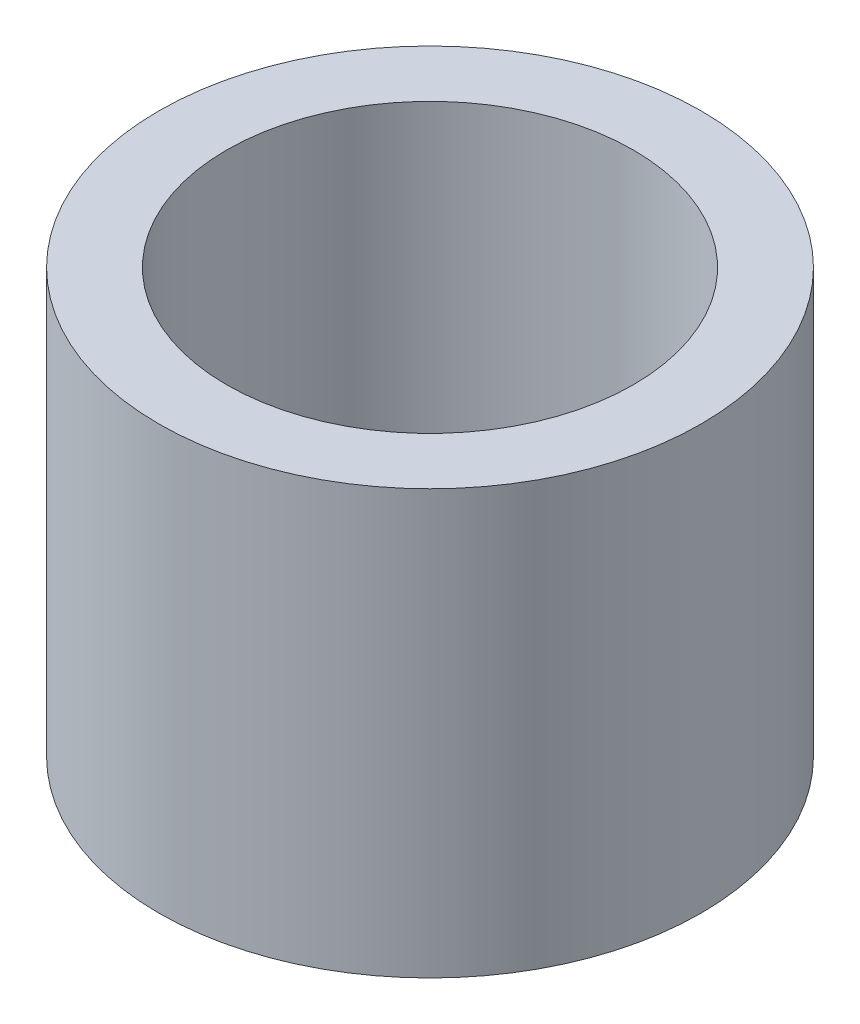
from build123d import *

# Parameters (mm, degrees)
SKETCH1_R           = 16
SKETCH1_R_2         = 12
BOSS_EXTRUDE1_DEPTH = 25


with BuildPart() as part:
    # Sketch1 → Boss-Extrude1 (new body)
    with BuildSketch(Plane(origin=(0, 0, 0), x_dir=(1, 0, 0), z_dir=(0, 1, 0))):
        with Locations(Location((0, 0, 0), (0, 0, 270))):
            Circle(SKETCH1_R)
        with Locations(Location((0, 0, 0), (0, 0, 270))):
            Circle(SKETCH1_R_2, mode=Mode.SUBTRACT)
    extrude(amount=BOSS_EXTRUDE1_DEPTH)


solid = part.part
